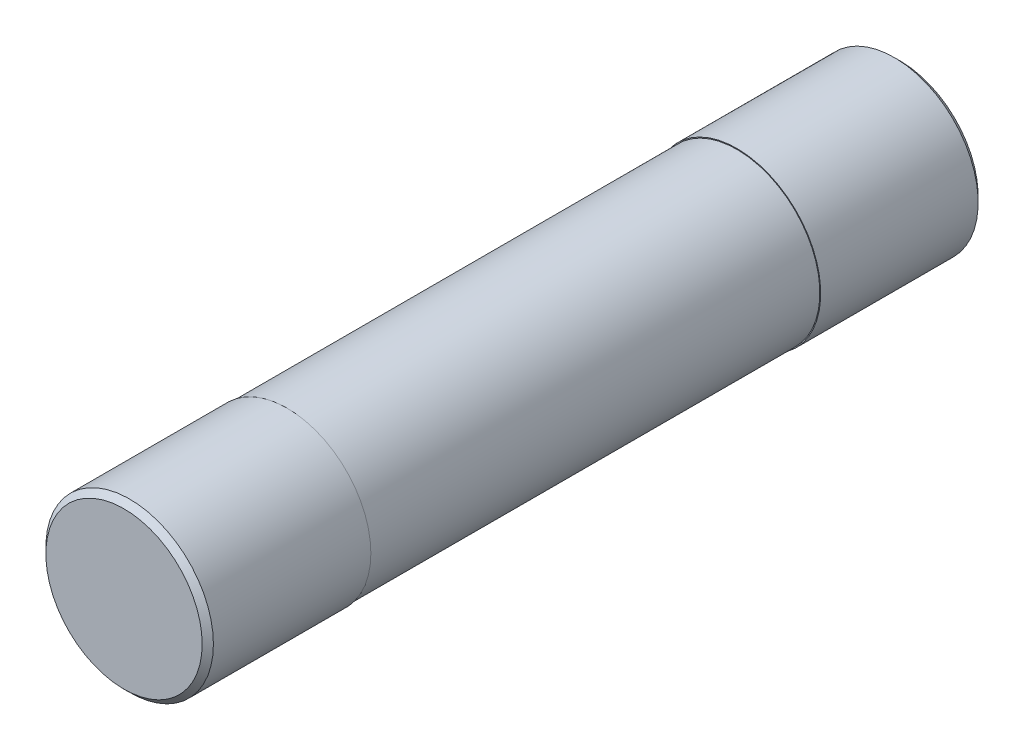
from build123d import *

# Parameters (mm, degrees)
SKETCH_1_R      = 1.475
EXTRUDE_1_DEPTH = 8
SKETCH_2_R      = 1.49
EXTRUDE_2_DEPTH = 2.9
EXTRUDE_START   = 2.9
SKETCH_3_R      = 1.49
EXTRUDE_3_DEPTH = 2.9
CHAMFER_1_SIZE  = 0.1


with BuildPart() as part:
    # 스케치1 → 보스-돌출1 (new body)
    with BuildSketch(Plane.XY):
        Circle(SKETCH_1_R)
    extrude(amount=EXTRUDE_1_DEPTH)

    # 스케치2 → 보스-돌출2 (add)
    with BuildSketch(Plane(origin=(0, 0, 0), x_dir=(-1, 0, 0), z_dir=(0, 0, -1))):
        Circle(SKETCH_2_R)
    extrude(amount=EXTRUDE_2_DEPTH)

    # 스케치3 → 보스-돌출3 (add)
    with BuildSketch(Plane.XY.offset(8).offset(EXTRUDE_START)):
        with Locations(Location((0, 0, 0), (0, 0, 180))):
            Circle(SKETCH_3_R)
    extrude(amount=-EXTRUDE_3_DEPTH)

    # 모따기1
    chamfer_1_edges = [part.edges().sort_by_distance(p)[0] for p in [
        (1.49, 0, -2.9),
        (1.49, 0, 10.9),
    ]]
    chamfer(chamfer_1_edges, length=CHAMFER_1_SIZE)


solid = part.part
